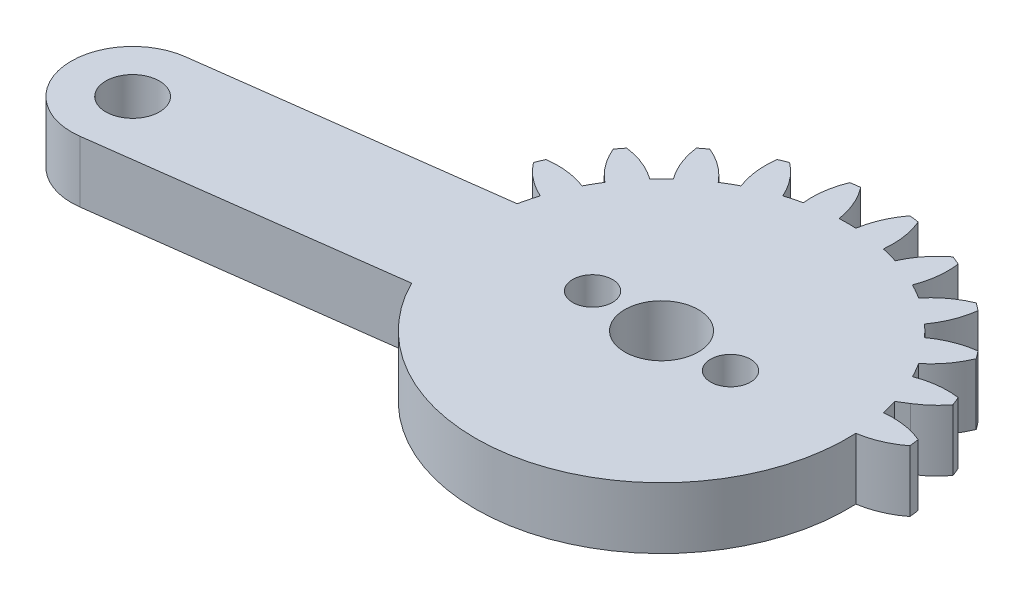
from build123d import *

# Parameters (mm, degrees)
SKETCH1_R           = 1.5
BOSS_EXTRUDE1_DEPTH = 4
SCALE1_SCALE        = 1.004
BOSS_EXTRUDE2_START = -4
SKETCH3_R           = 1.506
SKETCH3_R_2         = 1.5
SKETCH3_R_3         = 1.75
BOSS_EXTRUDE2_DEPTH = 4
CUT_EXTRUDE1_START  = -4.016
CUT_EXTRUDE1_DEPTH  = 4.016
CUT_EXTRUDE2_REACH  = 49.112
SKETCH5_R           = 1.3
SKETCH5_R_2         = 2.4
SKETCH6_W           = 34.675859163
SKETCH6_H           = 30.444089621
CUT_EXTRUDE3_DEPTH  = 0.016


with BuildPart() as part:
    # Sketch1 → Boss-Extrude1 (new body)
    with BuildSketch(Plane(origin=(0, 0, 0), x_dir=(1, 0, 0), z_dir=(0, 1, 0))):
        with BuildLine():
            Line((20.643657446, 4), (2.081641936, 4))
            ThreePointArc((2.081641936, 4), (2.861028333, 4.588201733), (3.521749436, 5.30713988))
            ThreePointArc((3.521749436, 5.30713988), (3.405395609, 5.596745198), (3.282888305, 5.883801663))
            ThreePointArc((3.282888305, 5.883801663), (1.93527598, 5.894040025), (0.627094961, 5.57027124))
            ThreePointArc((0.627094961, 5.57027124), (0.366286148, 6.046375), (0.084372603, 6.510293938))
            ThreePointArc((0.084372603, 6.510293938), (1.018855105, 7.48132754), (1.683794586, 8.65351323))
            ThreePointArc((1.683794586, 8.65351323), (1.496450048, 8.903135899), (1.303821399, 9.148703928))
            ThreePointArc((1.303821399, 9.148703928), (-0.000522033, 8.809805691), (-1.180330337, 8.158486898))
            ThreePointArc((-1.180330337, 8.158486898), (-1.555477026, 8.550865528), (-1.947855656, 8.926012217))
            ThreePointArc((-1.947855656, 8.926012217), (-1.296536862, 10.105820521), (-0.957638625, 11.410163953))
            ThreePointArc((-0.957638625, 11.410163953), (-1.203206655, 11.602792602), (-1.452829324, 11.79013714))
            ThreePointArc((-1.452829324, 11.79013714), (-2.625015014, 11.125197659), (-3.596048616, 10.190715157))
            ThreePointArc((-3.596048616, 10.190715157), (-4.059967554, 10.472628702), (-4.536071314, 10.733437515))
            ThreePointArc((-4.536071314, 10.733437515), (-4.212302529, 12.041618533), (-4.222540891, 13.389230859))
            ThreePointArc((-4.222540891, 13.389230859), (-4.509597355, 13.511738163), (-4.799202674, 13.62809199))
            ThreePointArc((-4.799202674, 13.62809199), (-5.759348103, 12.682425791), (-6.455432668, 11.528463019))
            ThreePointArc((-6.455432668, 11.528463019), (-6.976508546, 11.680699536), (-7.503891752, 11.809396783))
            ThreePointArc((-7.503891752, 11.809396783), (-7.529737283, 13.156800143), (-7.888414517, 14.455843809))
            ThreePointArc((-7.888414517, 14.455843809), (-8.197396993, 14.499881098), (-8.507248835, 14.537314892))
            ThreePointArc((-8.507248835, 14.537314892), (-9.18992168, 13.375367565), (-9.563620196, 12.080565177))
            ThreePointArc((-9.563620196, 12.080565177), (-10.106342554, 12.09275), (-10.649064912, 12.080565177))
            ThreePointArc((-10.649064912, 12.080565177), (-11.022763428, 13.375367565), (-11.705436272, 14.537314892))
            ThreePointArc((-11.705436272, 14.537314892), (-12.015288115, 14.499881098), (-12.324270591, 14.455843809))
            ThreePointArc((-12.324270591, 14.455843809), (-12.682947825, 13.156800143), (-12.708793355, 11.809396783))
            ThreePointArc((-12.708793355, 11.809396783), (-13.236176561, 11.680699536), (-13.757252439, 11.528463019))
            ThreePointArc((-13.757252439, 11.528463019), (-14.453337005, 12.682425791), (-15.413482434, 13.62809199))
            ThreePointArc((-15.413482434, 13.62809199), (-15.703087752, 13.511738163), (-15.990144217, 13.389230859))
            ThreePointArc((-15.990144217, 13.389230859), (-16.000382579, 12.041618533), (-15.676613793, 10.733437515))
            ThreePointArc((-15.676613793, 10.733437515), (-16.152717554, 10.472628702), (-16.616636492, 10.190715157))
            ThreePointArc((-16.616636492, 10.190715157), (-17.587670094, 11.125197659), (-18.759855783, 11.79013714))
            ThreePointArc((-18.759855783, 11.79013714), (-19.009478453, 11.602792602), (-19.255046482, 11.410163953))
            ThreePointArc((-19.255046482, 11.410163953), (-18.916148245, 10.105820521), (-18.264829452, 8.926012217))
            ThreePointArc((-18.264829452, 8.926012217), (-18.657208082, 8.550865528), (-19.032354771, 8.158486898))
            ThreePointArc((-19.032354771, 8.158486898), (-20.212163074, 8.809805691), (-21.516506507, 9.148703928))
            ThreePointArc((-21.516506507, 9.148703928), (-21.709135156, 8.903135899), (-21.896479694, 8.65351323))
            ThreePointArc((-21.896479694, 8.65351323), (-21.231540213, 7.48132754), (-20.297057711, 6.510293938))
            ThreePointArc((-20.297057711, 6.510293938), (-20.578971255, 6.046375), (-20.839780068, 5.57027124))
            ThreePointArc((-20.839780068, 5.57027124), (-22.147961087, 5.894040025), (-23.495573413, 5.883801663))
            ThreePointArc((-23.495573413, 5.883801663), (-23.618080717, 5.596745198), (-23.734434544, 5.30713988))
            ThreePointArc((-23.734434544, 5.30713988), (-22.788768345, 4.346994451), (-21.634805572, 3.650909885))
            ThreePointArc((-21.634805572, 3.650909885), (-21.78704209, 3.129834008), (-21.915739337, 2.602450802))
            ThreePointArc((-21.915739337, 2.602450802), (-23.263142697, 2.576605271), (-24.562186363, 2.217928037))
            ThreePointArc((-24.562186363, 2.217928037), (-24.606223651, 1.908945561), (-24.643657446, 1.599093719))
            ThreePointArc((-24.643657446, 1.599093719), (-23.481710119, 0.916420874), (-22.186907731, 0.542722358))
            ThreePointArc((-22.186907731, 0.542722358), (-22.199092554, 0), (-22.186907731, -0.542722358))
            ThreePointArc((-22.186907731, -0.542722358), (-23.481710119, -0.916420874), (-24.643657446, -1.599093719))
            ThreePointArc((-24.643657446, -1.599093719), (-24.606223651, -1.908945561), (-24.562186363, -2.217928037))
            ThreePointArc((-24.562186363, -2.217928037), (-23.263142697, -2.576605271), (-21.915739337, -2.602450802))
            ThreePointArc((-21.915739337, -2.602450802), (-21.78704209, -3.129834008), (-21.634805572, -3.650909885))
            ThreePointArc((-21.634805572, -3.650909885), (-22.788768345, -4.346994451), (-23.734434544, -5.30713988))
            ThreePointArc((-23.734434544, -5.30713988), (-23.618080717, -5.596745198), (-23.495573413, -5.883801663))
            ThreePointArc((-23.495573413, -5.883801663), (-22.147961087, -5.894040025), (-20.839780068, -5.57027124))
            ThreePointArc((-20.839780068, -5.57027124), (-20.578971255, -6.046375), (-20.297057711, -6.510293938))
            ThreePointArc((-20.297057711, -6.510293938), (-21.231540213, -7.48132754), (-21.896479694, -8.65351323))
            ThreePointArc((-21.896479694, -8.65351323), (-21.709135156, -8.903135899), (-21.516506507, -9.148703928))
            ThreePointArc((-21.516506507, -9.148703928), (-20.212163074, -8.809805691), (-19.032354771, -8.158486898))
            ThreePointArc((-19.032354771, -8.158486898), (-18.657208082, -8.550865528), (-18.264829452, -8.926012217))
            ThreePointArc((-18.264829452, -8.926012217), (-18.916148245, -10.105820521), (-19.255046482, -11.410163953))
            ThreePointArc((-19.255046482, -11.410163953), (-19.009478453, -11.602792602), (-18.759855783, -11.79013714))
            ThreePointArc((-18.759855783, -11.79013714), (-17.587670094, -11.125197659), (-16.616636492, -10.190715157))
            ThreePointArc((-16.616636492, -10.190715157), (-16.152717554, -10.472628702), (-15.676613793, -10.733437515))
            ThreePointArc((-15.676613793, -10.733437515), (-16.000382579, -12.041618533), (-15.990144217, -13.389230859))
            ThreePointArc((-15.990144217, -13.389230859), (-15.703087752, -13.511738163), (-15.413482434, -13.62809199))
            ThreePointArc((-15.413482434, -13.62809199), (-14.453337005, -12.682425791), (-13.757252439, -11.528463019))
            ThreePointArc((-13.757252439, -11.528463019), (-13.236176561, -11.680699536), (-12.708793355, -11.809396783))
            ThreePointArc((-12.708793355, -11.809396783), (-12.682947825, -13.156800143), (-12.324270591, -14.455843809))
            ThreePointArc((-12.324270591, -14.455843809), (-12.015288115, -14.499881098), (-11.705436272, -14.537314892))
            ThreePointArc((-11.705436272, -14.537314892), (-11.022763428, -13.375367565), (-10.649064912, -12.080565177))
            ThreePointArc((-10.649064912, -12.080565177), (-10.106342554, -12.09275), (-9.563620196, -12.080565177))
            ThreePointArc((-9.563620196, -12.080565177), (-9.18992168, -13.375367565), (-8.507248835, -14.537314892))
            ThreePointArc((-8.507248835, -14.537314892), (-8.197396993, -14.499881098), (-7.888414517, -14.455843809))
            ThreePointArc((-7.888414517, -14.455843809), (-7.529737283, -13.156800143), (-7.503891752, -11.809396783))
            ThreePointArc((-7.503891752, -11.809396783), (-6.976508546, -11.680699536), (-6.455432668, -11.528463019))
            ThreePointArc((-6.455432668, -11.528463019), (-5.759348103, -12.682425791), (-4.799202674, -13.62809199))
            ThreePointArc((-4.799202674, -13.62809199), (-4.509597355, -13.511738163), (-4.222540891, -13.389230859))
            ThreePointArc((-4.222540891, -13.389230859), (-4.212302529, -12.041618533), (-4.536071314, -10.733437515))
            ThreePointArc((-4.536071314, -10.733437515), (-4.059967554, -10.472628702), (-3.596048616, -10.190715157))
            ThreePointArc((-3.596048616, -10.190715157), (-2.625015014, -11.125197659), (-1.452829324, -11.79013714))
            ThreePointArc((-1.452829324, -11.79013714), (-1.203206655, -11.602792602), (-0.957638625, -11.410163953))
            ThreePointArc((-0.957638625, -11.410163953), (-1.296536862, -10.105820521), (-1.947855656, -8.926012217))
            ThreePointArc((-1.947855656, -8.926012217), (-1.555477026, -8.550865528), (-1.180330337, -8.158486898))
            ThreePointArc((-1.180330337, -8.158486898), (-0.000522033, -8.809805691), (1.303821399, -9.148703928))
            ThreePointArc((1.303821399, -9.148703928), (1.496450048, -8.903135899), (1.683794586, -8.65351323))
            ThreePointArc((1.683794586, -8.65351323), (1.018855105, -7.48132754), (0.084372603, -6.510293938))
            ThreePointArc((0.084372603, -6.510293938), (0.366286148, -6.046375), (0.627094961, -5.57027124))
            ThreePointArc((0.627094961, -5.57027124), (1.93527598, -5.894040025), (3.282888305, -5.883801663))
            ThreePointArc((3.282888305, -5.883801663), (3.405395609, -5.596745198), (3.521749436, -5.30713988))
            ThreePointArc((3.521749436, -5.30713988), (2.861028333, -4.588201733), (2.081641936, -4))
            Line((2.081641936, -4), (20.643657446, -4))
            ThreePointArc((20.643657446, -4), (24.643657446, 0), (20.643657446, 4))
        make_face()
        with Locations(Location((-10.106342554, 0, 0), (0, 0, 270))):
            Circle(SKETCH1_R, mode=Mode.SUBTRACT)
        with Locations(Location((20.643657446, 0, 0), (0, 0, 270))):
            Circle(SKETCH1_R, mode=Mode.SUBTRACT)
    extrude(amount=BOSS_EXTRUDE1_DEPTH)


with BuildPart() as part_1:
    # Scale1: scaled about (-4.879650277, 2, 0)
    add(part.part.scale(SCALE1_SCALE).moved(Location((0.019518601, -0.008, 0))))

    # Sketch3 → Boss-Extrude2 (add)
    # profile 1 of 2: a face of its own
    with BuildSketch(Plane(origin=(0, 4.008, 0), x_dir=(1, 0, 0), z_dir=(0, 1, 0)).offset(BOSS_EXTRUDE2_START)):
        with Locations(Location((-10.127249323, 0, 0), (0, 0, 270))):
            Circle(SKETCH3_R)
        with Locations(Location((-10.127249323, 0, 0), (0, 0, 270))):
            Circle(SKETCH3_R_2, mode=Mode.SUBTRACT)
    # profile 2 of 2: a face of its own
    with BuildSketch(Plane(origin=(0, 4.008, 0), x_dir=(1, 0, 0), z_dir=(0, 1, 0)).offset(BOSS_EXTRUDE2_START)):
        with BuildLine():
            ThreePointArc((-24.640916507, -2.226799749), (-24.685129945, -1.916581343), (-24.722713475, -1.605490094))
            ThreePointArc((-24.722713475, -1.605490094), (-23.556118358, -0.920086558), (-22.256136761, -0.544893247))
            ThreePointArc((-22.256136761, -0.544893247), (-22.268370323, 0), (-22.256136761, 0.544893247))
            ThreePointArc((-22.256136761, 0.544893247), (-23.556118358, 0.920086558), (-24.722713475, 1.605490094))
            ThreePointArc((-24.722713475, 1.605490094), (-24.69197129, 1.863879361), (-24.656655102, 2.121683283))
            Line((-24.656655102, 2.121683283), (-41.136283579, -0.047900965))
            ThreePointArc((-41.136283579, -0.047900965), (-44.579958256, -4.53578518), (-40.092074041, -7.979459856))
            Line((-40.092074041, -7.979459856), (-23.612445564, -5.809875608))
            ThreePointArc((-23.612445564, -5.809875608), (-23.713282947, -5.569996643), (-23.809853681, -5.32836844))
            ThreePointArc((-23.809853681, -5.32836844), (-22.860404818, -4.364382429), (-21.701826194, -3.665513525))
            ThreePointArc((-21.701826194, -3.665513525), (-21.854671657, -3.142353344), (-21.983883693, -2.612860605))
            ThreePointArc((-21.983883693, -2.612860605), (-23.336676666, -2.586911692), (-24.640916507, -2.226799749))
        make_face()
        with Locations(Location((-40.61417881, -4.013680411, 0), (0, 0, 270))):
            Circle(SKETCH3_R_3, mode=Mode.SUBTRACT)
    extrude(amount=BOSS_EXTRUDE2_DEPTH)

    # Sketch4 → Cut-Extrude1 (cut)
    with BuildSketch(Plane(origin=(0, 4.008, 0), x_dir=(1, 0, 0), z_dir=(0, 1, 0)).offset(CUT_EXTRUDE1_START)):
        with BuildLine():
            ThreePointArc((20.745750677, -4.016), (24.761750677, 0), (20.745750677, 4.016))
            Line((20.745750677, 4.016), (2.109487105, 4.016))
            Line((2.109487105, 4.016), (1.463351142, 3.614526248))
            ThreePointArc((1.463351142, 3.614526248), (1.607061005, 3.116533373), (1.729385048, 2.612860605))
            ThreePointArc((1.729385048, 2.612860605), (3.08217802, 2.586911692), (4.386417861, 2.226799749))
            ThreePointArc((4.386417861, 2.226799749), (4.430631299, 1.916581343), (4.468214829, 1.605490094))
            ThreePointArc((4.468214829, 1.605490094), (3.301619712, 0.920086558), (2.001638115, 0.544893247))
            ThreePointArc((2.001638115, 0.544893247), (1.729385048, -2.612860605), (0.649121942, -5.592552325))
            ThreePointArc((0.649121942, -5.592552325), (1.962535685, -5.917616185), (3.315538459, -5.907336869))
            ThreePointArc((3.315538459, -5.907336869), (3.438535793, -5.619132179), (3.555355035, -5.32836844))
            ThreePointArc((3.555355035, -5.32836844), (2.891991048, -4.60655454), (2.109487105, -4.016))
            Line((2.109487105, -4.016), (20.745750677, -4.016))
        make_face()
        with BuildLine():
            ThreePointArc((1.710048366, -8.688127282), (1.042449127, -7.51125285), (0.104228694, -6.536335114))
            ThreePointArc((0.104228694, -6.536335114), (-0.495050423, -7.39104617), (-1.165533057, -8.191120846))
            ThreePointArc((-1.165533057, -8.191120846), (0.01899448, -8.845044914), (1.328555286, -9.185298744))
            ThreePointArc((1.328555286, -9.185298744), (1.521954449, -8.938748443), (1.710048366, -8.688127282))
        make_face()
        with BuildLine():
            ThreePointArc((-0.941950579, -11.455804609), (-1.282204409, -10.146243803), (-1.936128477, -8.961716266))
            ThreePointArc((-1.936128477, -8.961716266), (-2.736203153, -9.6321989), (-3.590914209, -10.231478017))
            ThreePointArc((-3.590914209, -10.231478017), (-2.615996473, -11.16969845), (-1.43912204, -11.837297689))
            ThreePointArc((-1.43912204, -11.837297689), (-1.18850088, -11.649203772), (-0.941950579, -11.455804609))
        make_face()
        with BuildLine():
            ThreePointArc((-4.219912453, -13.442787782), (-4.209633138, -12.089785007), (-4.534696998, -10.776371265))
            ThreePointArc((-4.534696998, -10.776371265), (-5.481043466, -11.216933194), (-6.461735798, -11.574576871))
            ThreePointArc((-6.461735798, -11.574576871), (-5.762866894, -12.733155495), (-4.798880883, -13.682604358))
            ThreePointArc((-4.798880883, -13.682604358), (-4.508117144, -13.565785116), (-4.219912453, -13.442787782))
        make_face()
        with BuildLine():
            ThreePointArc((-7.900449573, -14.513667184), (-7.540337631, -13.209427343), (-7.514388718, -11.856634371))
            ThreePointArc((-7.514388718, -11.856634371), (-8.54251503, -12.037252027), (-9.582356076, -12.128887438))
            ThreePointArc((-9.582356076, -12.128887438), (-9.207162765, -13.428869035), (-8.521759229, -14.595464152))
            ThreePointArc((-8.521759229, -14.595464152), (-8.210667979, -14.557880622), (-7.900449573, -14.513667184))
        make_face()
        with BuildLine():
            ThreePointArc((-11.732739416, -14.595464152), (-11.047335881, -13.428869035), (-10.67214257, -12.128887438))
            ThreePointArc((-10.67214257, -12.128887438), (-11.711983616, -12.037252027), (-12.740109928, -11.856634371))
            ThreePointArc((-12.740109928, -11.856634371), (-12.714161015, -13.209427343), (-12.354049072, -14.513667184))
            ThreePointArc((-12.354049072, -14.513667184), (-12.043830666, -14.557880622), (-11.732739416, -14.595464152))
        make_face()
        with BuildLine():
            ThreePointArc((-15.455617763, -13.682604358), (-14.491631752, -12.733155495), (-13.792762848, -11.574576871))
            ThreePointArc((-13.792762848, -11.574576871), (-14.77345518, -11.216933194), (-15.719801648, -10.776371265))
            ThreePointArc((-15.719801648, -10.776371265), (-16.044865508, -12.089785007), (-16.034586192, -13.442787782))
            ThreePointArc((-16.034586192, -13.442787782), (-15.746381502, -13.565785116), (-15.455617763, -13.682604358))
        make_face()
        with BuildLine():
            ThreePointArc((-18.815376605, -11.837297689), (-17.638502173, -11.16969845), (-16.663584436, -10.231478017))
            ThreePointArc((-16.663584436, -10.231478017), (-17.518295493, -9.6321989), (-18.318370168, -8.961716266))
            ThreePointArc((-18.318370168, -8.961716266), (-18.972294237, -10.146243803), (-19.312548067, -11.455804609))
            ThreePointArc((-19.312548067, -11.455804609), (-19.065997766, -11.649203772), (-18.815376605, -11.837297689))
        make_face()
        with BuildLine():
            ThreePointArc((-21.583053932, -9.185298744), (-20.273493126, -8.845044914), (-19.088965589, -8.191120846))
            ThreePointArc((-19.088965589, -8.191120846), (-19.759448223, -7.39104617), (-20.35872734, -6.536335114))
            ThreePointArc((-20.35872734, -6.536335114), (-21.296947773, -7.51125285), (-21.964547012, -8.688127282))
            ThreePointArc((-21.964547012, -8.688127282), (-21.776453095, -8.938748443), (-21.583053932, -9.185298744))
        make_face()
        with BuildLine():
            ThreePointArc((-22.014565473, 2.469520982), (-21.999440913, 2.541237098), (-21.983883693, 2.612860605))
            ThreePointArc((-21.983883693, 2.612860605), (-23.336676666, 2.586911692), (-24.640916507, 2.226799749))
            ThreePointArc((-24.640916507, 2.226799749), (-24.648880917, 2.174255757), (-24.656655102, 2.121683283))
            Line((-24.656655102, 2.121683283), (-22.014565473, 2.469520982))
        make_face()
        with BuildLine():
            ThreePointArc((-23.570037105, -5.907336869), (-22.21703433, -5.917616185), (-20.903620588, -5.592552325))
            ThreePointArc((-20.903620588, -5.592552325), (-20.937185235, -5.527395835), (-20.970355936, -5.462037909))
            Line((-20.970355936, -5.462037909), (-23.612445564, -5.809875608))
            ThreePointArc((-23.612445564, -5.809875608), (-23.591329521, -5.858644611), (-23.570037105, -5.907336869))
        make_face()
    extrude(amount=CUT_EXTRUDE1_DEPTH, mode=Mode.SUBTRACT)

    # Sketch5 → Cut-Extrude2 (cut, up to next)
    with BuildSketch(Plane(origin=(0, 4.008, 0), x_dir=(1, 0, 0), z_dir=(0, 1, 0)), mode=Mode.PRIVATE) as cut_extrude2_sk1:
        with Locations(Location((-14.627249323, 0, 0), (0, 0, 270))):
            Circle(SKETCH5_R)
    cut_extrude2_tool1 = extrude(cut_extrude2_sk1.sketch, amount=-CUT_EXTRUDE2_REACH, mode=Mode.PRIVATE) & part_1.part
    # Sketch5 → Cut-Extrude2 (cut, up to next)
    with BuildSketch(Plane(origin=(0, 4.008, 0), x_dir=(1, 0, 0), z_dir=(0, 1, 0)), mode=Mode.PRIVATE) as cut_extrude2_sk2:
        with Locations(Location((-5.627249323, 0, 0), (0, 0, 270))):
            Circle(SKETCH5_R)
    cut_extrude2_tool2 = extrude(cut_extrude2_sk2.sketch, amount=-CUT_EXTRUDE2_REACH, mode=Mode.PRIVATE) & part_1.part
    # Sketch5 → Cut-Extrude2 (cut, up to next)
    with BuildSketch(Plane(origin=(0, 4.008, 0), x_dir=(1, 0, 0), z_dir=(0, 1, 0)), mode=Mode.PRIVATE) as cut_extrude2_sk3:
        with Locations(Location((-10.127249323, 0, 0), (0, 0, 270))):
            Circle(SKETCH5_R_2)
    cut_extrude2_tool3 = extrude(cut_extrude2_sk3.sketch, amount=-CUT_EXTRUDE2_REACH, mode=Mode.PRIVATE) & part_1.part
    add(cut_extrude2_tool1.solids().sort_by_distance((-14.627249, 4.008, 0))[0], mode=Mode.SUBTRACT)
    add(cut_extrude2_tool2.solids().sort_by_distance((-5.627249, 4.008, 0))[0], mode=Mode.SUBTRACT)
    add(cut_extrude2_tool3.solids().sort_by_distance((-10.127249, 4.008, 0))[0], mode=Mode.SUBTRACT)

    # Sketch6 → Cut-Extrude3 (cut)
    with BuildSketch(Plane.XZ.offset(0.008)):
        with Locations((-9.760611553, -1.350426999)):
            Rectangle(SKETCH6_W, SKETCH6_H)
    extrude(amount=-CUT_EXTRUDE3_DEPTH, mode=Mode.SUBTRACT)


solid = part_1.part
